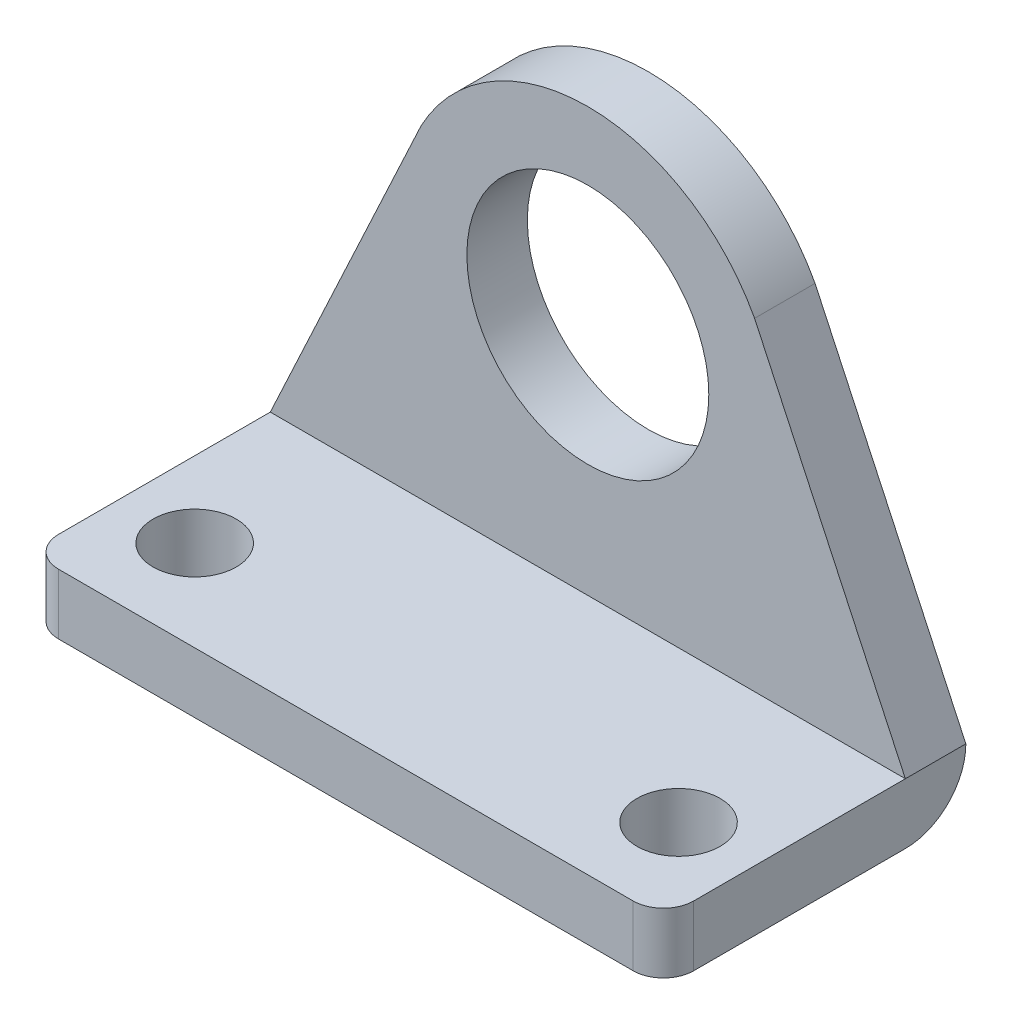
from build123d import *

# Parameters (mm, degrees)
SKETCH1_R           = 8
BOSS_EXTRUDE1_DEPTH = 4
SKETCH2_R           = 2.75
BOSS_EXTRUDE2_DEPTH = 4
BOSS_EXTRUDE3_DEPTH = 42


with BuildPart() as part:
    # Sketch1 → Boss-Extrude1 (new body)
    with BuildSketch(Plane.XY):
        with BuildLine():
            Line((0, 0), (9.971912122, 21.384834556))
            ThreePointArc((9.971912122, 21.384834556), (21, 28), (32.028087878, 21.384834556))
            Line((32.028087878, 21.384834556), (42, 0))
            Line((42, 0), (0, 0))
        make_face()
        with Locations((21, 15.5)):
            Circle(SKETCH1_R, mode=Mode.SUBTRACT)
    extrude(amount=BOSS_EXTRUDE1_DEPTH)



with BuildPart() as body_2:
    # Sketch2 → Boss-Extrude2 (new body)
    with BuildSketch(Plane(origin=(0, 0, 0), x_dir=(-1, 0, 0), z_dir=(0, -1, 0))):
        with BuildLine():
            Line((0, -4), (0, -18))
            ThreePointArc((0, -18), (-0.585786438, -19.414213562), (-2, -20))
            Line((-2, -20), (-40, -20))
            ThreePointArc((-40, -20), (-41.414213562, -19.414213562), (-42, -18))
            Line((-42, -18), (-42, -4))
            Line((-42, -4), (0, -4))
        make_face()
        with Locations(Location((-37, -14, 0), (0, 0, 90))):
            Circle(SKETCH2_R, mode=Mode.SUBTRACT)
        with Locations(Location((-5, -14, 0), (0, 0, 90))):
            Circle(SKETCH2_R, mode=Mode.SUBTRACT)
    extrude(amount=BOSS_EXTRUDE2_DEPTH)


with BuildPart() as part_1:
    add(part.part)

    add(body_2.part)  # Boss-Extrude3 merges body 2
    # Sketch3 → Boss-Extrude3 (add)
    with BuildSketch(Plane.ZY):
        with BuildLine():
            Line((4, 0), (0, 0))
            ThreePointArc((0, 0), (1.171572875, -2.828427125), (4, -4))
            Line((4, -4), (4, 0))
        make_face()
    extrude(amount=-BOSS_EXTRUDE3_DEPTH)


solid = part_1.part
